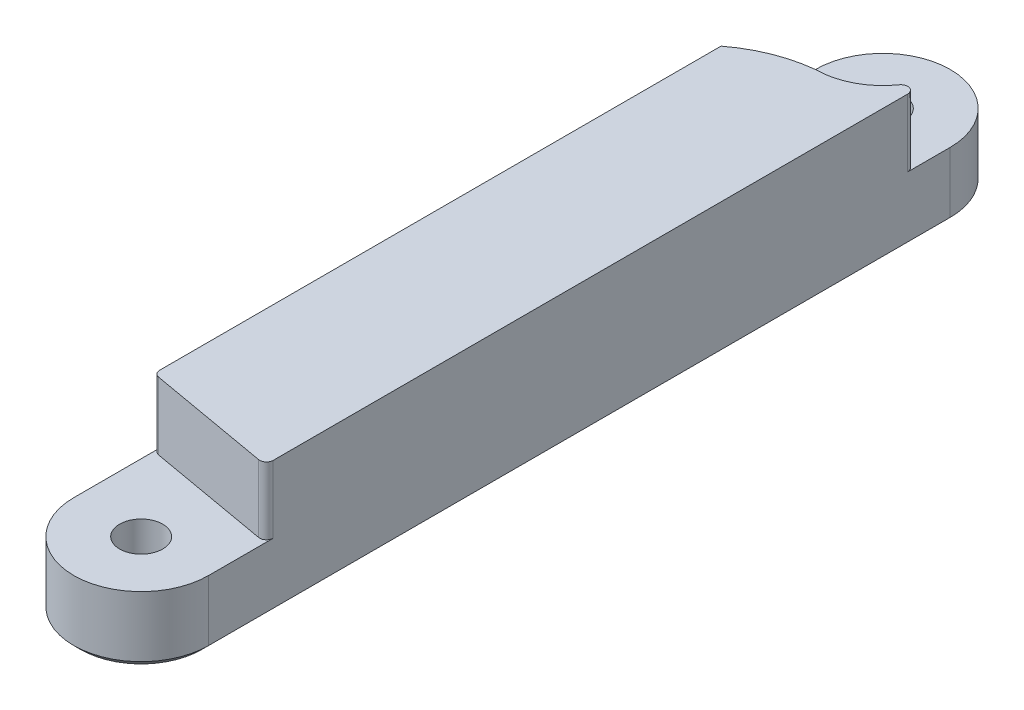
from build123d import *

# Parameters (mm, degrees)
CENTER_BODY_DEPTH               = 10
SKETCH1_3_R                     = 1.6
SKETCH1_3_R_2                   = 1.6000000000000003
CONNECTOR_BODY_DEPTH            = 5
MECH_LOCK_LEFT_DEPTH            = 5
DULLING_FILLET_GENERAL_R        = 0.5
ELEPHANTSFOOT_COMPENSATION_SIZE = 0.5
DULLING_FILLET_LEFT_R           = 0.5


with BuildPart() as part:
    # complete_sketch → center_body (new body)
    with BuildSketch(Plane(origin=(0, 0, 0), x_dir=(1, 0, 0), z_dir=(0, 1, 0))):
        Polygon((-5, 47), (-5, 5.958767962971026), (5, 4.195498155886416), (5, 47), align=None)
    extrude(amount=CENTER_BODY_DEPTH)

    # Sketch1<3> → connector_body (add)
    # profile 1 of 2: a face of its own
    with BuildSketch(Plane(origin=(0, 0, 0), x_dir=(1, 0, 0), z_dir=(0, 1, 0))):
        with BuildLine():
            Line((-5, 5.958767962971026), (-5, 0))
            ThreePointArc((-5, 0), (-3.1e-16, -5), (5, -6.1e-16))
            Line((5, 0), (5, 4.195498155886416))
            Line((5, 4.195498155886416), (-5, 5.958767962971026))
        make_face()
        Circle(SKETCH1_3_R, mode=Mode.SUBTRACT)
    # profile 2 of 2: a face of its own
    with BuildSketch(Plane(origin=(0, 0, 0), x_dir=(1, 0, 0), z_dir=(0, 1, 0))):
        with BuildLine():
            Line((-5, 55), (-5, 47))
            Line((-5, 47), (5, 47))
            Line((5.000000000000001, 47), (5, 55))
            ThreePointArc((5, 55), (-1.4e-16, 60), (-5, 55))
        make_face()
        with Locations((0, 55)):
            Circle(SKETCH1_3_R_2, mode=Mode.SUBTRACT)
    extrude(amount=CONNECTOR_BODY_DEPTH)

    # Sketch1 → mech_lock_left (add)
    with BuildSketch(Plane(origin=(0, 5, 0), x_dir=(1, 0, 0), z_dir=(0, 1, 0))):
        with BuildLine():
            Line((-5, 47), (5, 47))
            Line((5, 47), (5, 55))
            ThreePointArc((5, 55), (3.535533905932735, 51.46446609406726), (0, 49.99999999999999))
            ThreePointArc((0, 49.99999999999999), (-2.637161951805669, 49.34290487951417), (-4.999999999999999, 48))
            Line((-4.999999999999999, 48), (-5, 47))
        make_face()
    extrude(amount=MECH_LOCK_LEFT_DEPTH)

    # dulling_fillet_general
    dulling_fillet_general_edges = [part.edges().sort_by_distance(p)[0] for p in [
        (5, 7.5, -4.195498155886416),
        (-5, 7.5, -5.958767962971026),
    ]]
    fillet(dulling_fillet_general_edges, radius=DULLING_FILLET_GENERAL_R)

    # elephantsfoot_compensation
    elephantsfoot_compensation_edges = [part.edges().sort_by_distance(p)[0] for p in [
        (-1.6000000000000003, 0, -55),
        (-1.6, 0, -2e-16),
        (1.4e-16, 0, 5),
        (-1.4e-16, 0, -60),
        (5, 0, -27.5),
        (-5, 0, -27.5),
    ]]
    chamfer(elephantsfoot_compensation_edges, length=ELEPHANTSFOOT_COMPENSATION_SIZE)

    # dulling_fillet_left
    dulling_fillet_left_edges = [part.edges().sort_by_distance(p)[0] for p in [
        (5, 7.5, -55),
    ]]
    fillet(dulling_fillet_left_edges, radius=DULLING_FILLET_LEFT_R)


solid = part.part
